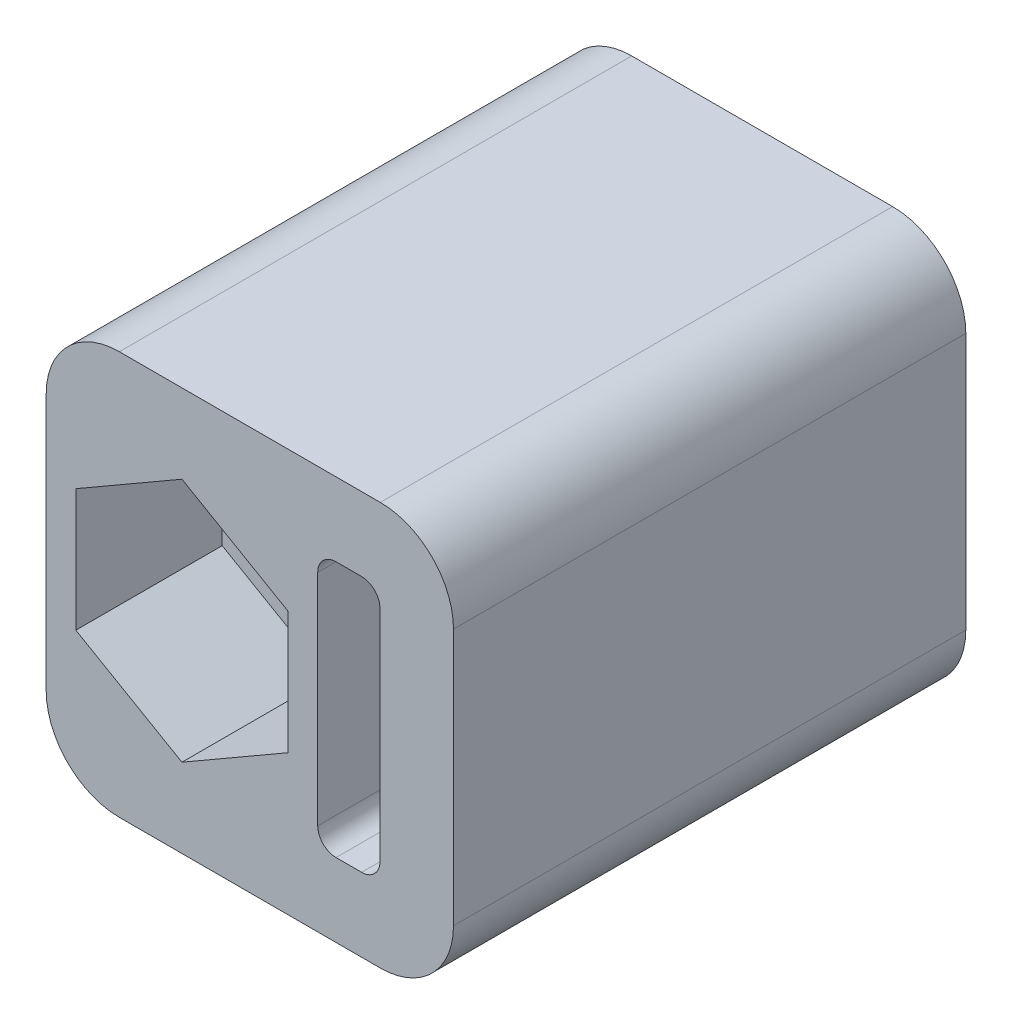
from build123d import *

# Parameters (mm, degrees)
SKETCH1_R           = 1.7
BOSS_EXTRUDE1_DEPTH = 14
CUT_EXTRUDE1_DEPTH  = 4


with BuildPart() as part:
    # Sketch1 → Boss-Extrude1 (new body)
    with BuildSketch(Plane.XY):
        with BuildLine():
            Line((5.42, 5.51), (-1.71, 5.51))
            ThreePointArc((-1.71, 5.51), (-3.124213562, 4.924213562), (-3.71, 3.51))
            Line((-3.71, 3.51), (-3.71, -3.51))
            ThreePointArc((-3.71, -3.51), (-3.124213562, -4.924213562), (-1.71, -5.51))
            Line((-1.71, -5.51), (5.42, -5.51))
            ThreePointArc((5.42, -5.51), (6.834213562, -4.924213562), (7.42, -3.51))
            Line((7.42, -3.51), (7.42, 3.51))
            ThreePointArc((7.42, 3.51), (6.834213562, 4.924213562), (5.42, 5.51))
        make_face()
        Circle(SKETCH1_R, mode=Mode.SUBTRACT)
        with BuildLine():
            Line((4.21, 3.5), (4.91, 3.5))
            ThreePointArc((4.91, 3.5), (5.263553391, 3.353553391), (5.41, 3))
            Line((5.41, 3), (5.41, -3))
            ThreePointArc((5.41, -3), (5.263553391, -3.353553391), (4.91, -3.5))
            Line((4.91, -3.5), (4.21, -3.5))
            ThreePointArc((4.21, -3.5), (3.856446609, -3.353553391), (3.71, -3))
            Line((3.71, -3), (3.71, 3))
            ThreePointArc((3.71, 3), (3.856446609, 3.353553391), (4.21, 3.5))
        make_face(mode=Mode.SUBTRACT)
    extrude(amount=BOSS_EXTRUDE1_DEPTH)

    # Sketch2 → Cut-Extrude1 (cut)
    with BuildSketch(Plane.XY.offset(14)):
        Polygon((0, 3.348631561), (-2.9, 1.674315781), (-2.9, -1.674315781), (0, -3.348631561), (2.9, -1.674315781), (2.9, 1.674315781), align=None)
    extrude(amount=-CUT_EXTRUDE1_DEPTH, mode=Mode.SUBTRACT)


solid = part.part
